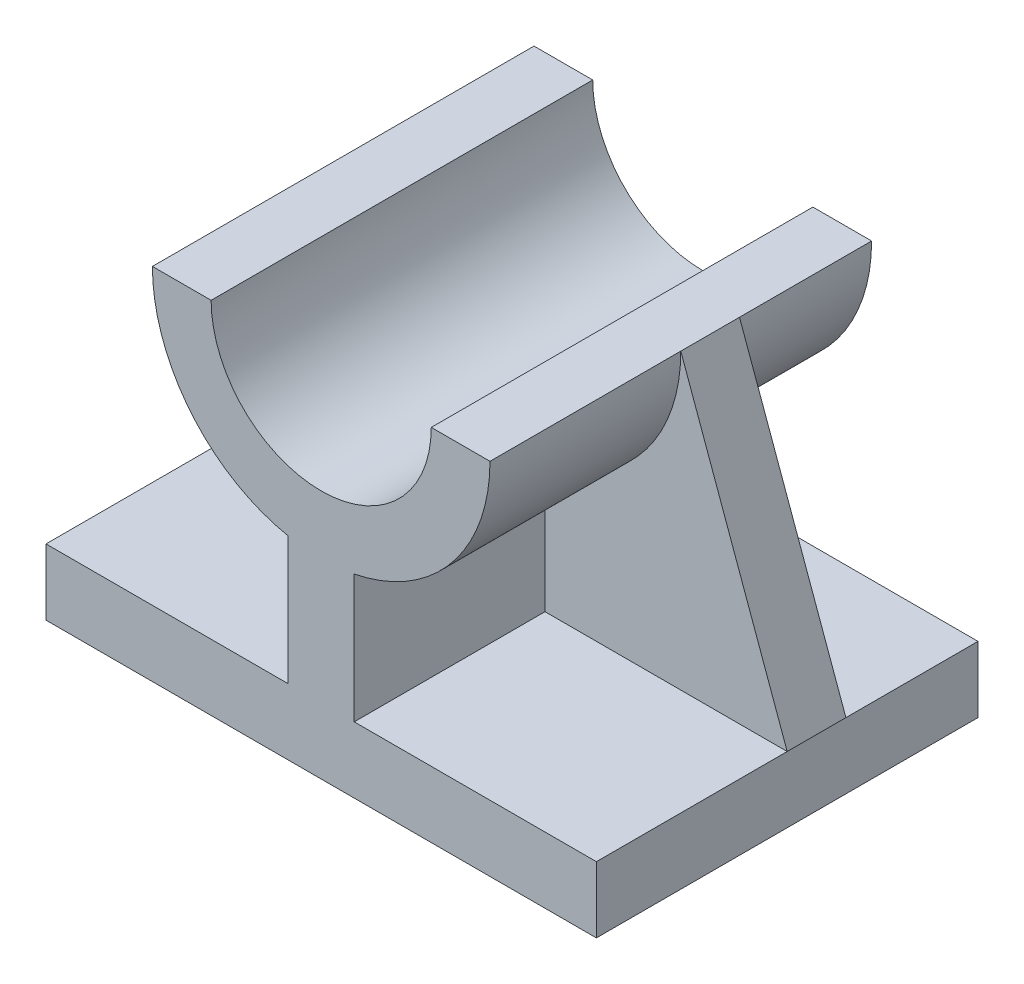
from build123d import *

# Parameters (mm, degrees)
SKETCH1_W           = 75
SKETCH1_H           = 52
BOSS_EXTRUDE1_DEPTH = 9
BOSS_EXTRUDE2_DEPTH = 52
RIB2_REACH          = 96.478
SKETCH5_WALL_W      = 233.502053902
SKETCH5_WALL_H      = 8


with BuildPart() as part:
    # Sketch1 → Boss-Extrude1 (new body)
    with BuildSketch(Plane(origin=(0, 0, 0), x_dir=(1, 0, 0), z_dir=(0, 1, 0))):
        with Locations((37.5, 26)):
            Rectangle(SKETCH1_W, SKETCH1_H)
    extrude(amount=BOSS_EXTRUDE1_DEPTH)

    # Sketch2 → Boss-Extrude2 (add)
    with BuildSketch(Plane.XY):
        with BuildLine():
            Line((33, 9), (33, 26.444512863))
            ThreePointArc((33, 26.444512863), (19.716580756, 34.414047854), (14.5, 49))
            Line((14.5, 49), (22.5, 49))
            ThreePointArc((22.5, 49), (37.5, 34), (52.5, 49))
            Line((52.5, 49), (60.5, 49))
            ThreePointArc((60.5, 49), (55.283419244, 34.414047854), (42, 26.444512863))
            Line((42, 26.444512863), (42, 9))
            Line((42, 9), (33, 9))
        make_face()
    extrude(amount=-BOSS_EXTRUDE2_DEPTH)

    # Sketch5 wall → Rib2 (add, up to next)
    with BuildSketch(Plane(origin=(67.75, 29, -30), x_dir=(0.340799323621, -0.940136065162, 0), z_dir=(0.940136065162, 0.340799323621, 0)), mode=Mode.PRIVATE) as rib2_sk1:
        Rectangle(SKETCH5_WALL_W, SKETCH5_WALL_H)
    rib2_tool1 = extrude(rib2_sk1.sketch, amount=-RIB2_REACH, mode=Mode.PRIVATE) - part.part
    rib2 = rib2_tool1.solids().sort_by_distance((67.75, 29, -30))[0]
    add(rib2)

    # Mirror2: Rib2 across plane
    add(rib2.mirror(Plane(origin=(37.5, 0, 0), x_dir=(0, 0, 1), z_dir=(1, 0, 0))))


solid = part.part
